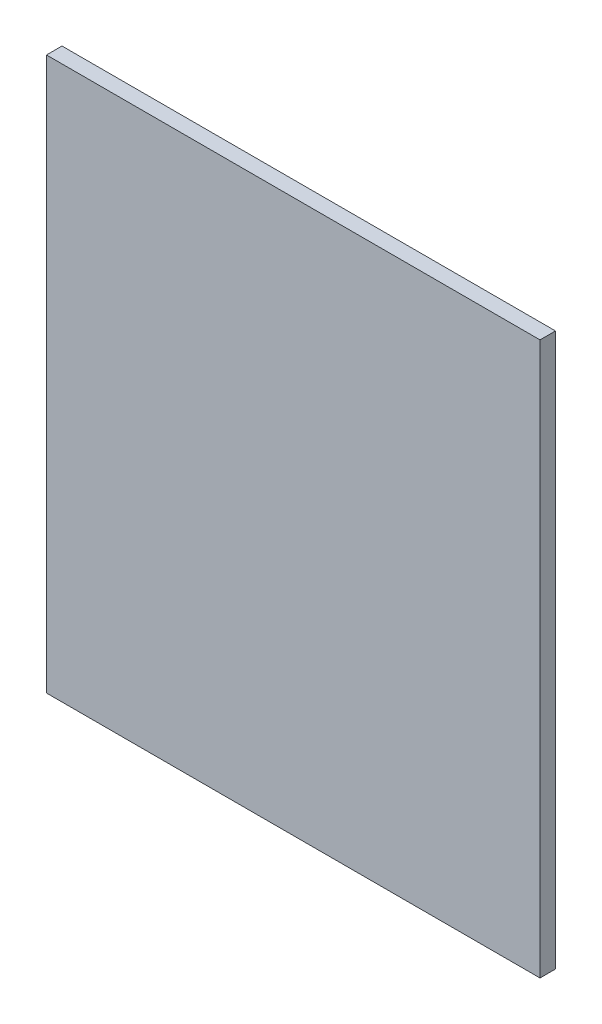
from build123d import *

# Parameters (mm, degrees)
SKETCH1_W           = 382.04
SKETCH1_H           = 427.8
BOSS_EXTRUDE1_DEPTH = 12


with BuildPart() as part:
    # Sketch1 → Boss-Extrude1 (new body)
    with BuildSketch(Plane.XY):
        with Locations((146.944035741, 181.938482058)):
            Rectangle(SKETCH1_W, SKETCH1_H)
    extrude(amount=BOSS_EXTRUDE1_DEPTH)


solid = part.part
